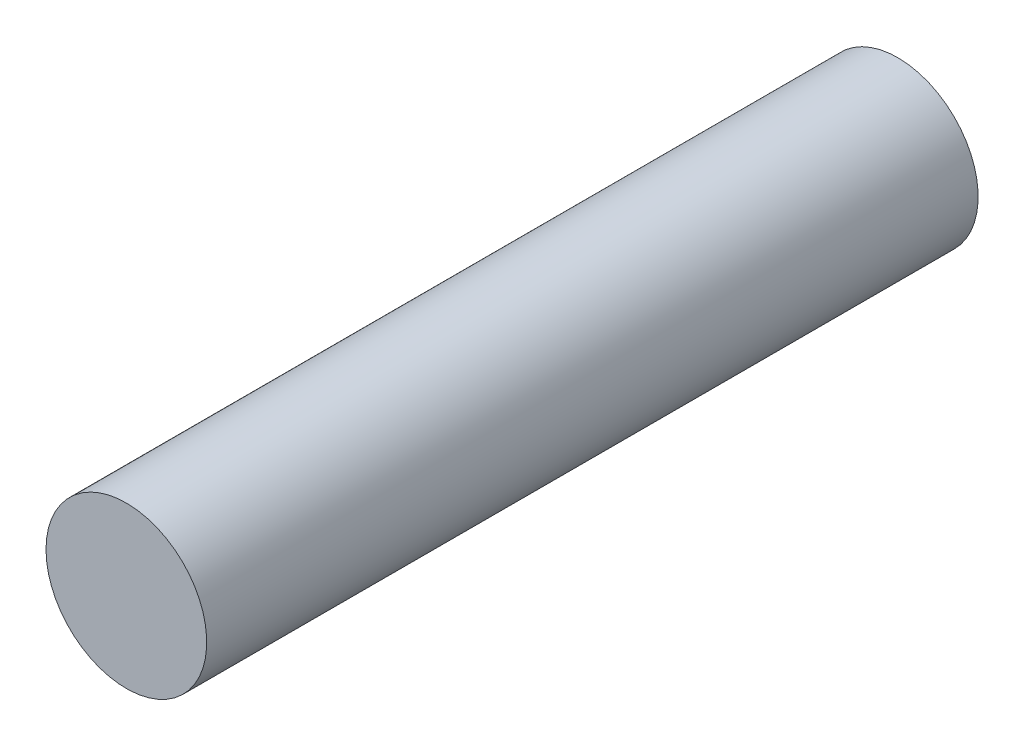
from build123d import *

# Parameters (mm, degrees)
BOSS_EXTRUDE1_DEPTH      = 76.2
BOSS_EXTRUDE1_DEPTH_BACK = 76.2
SKETCH3_R                = 15.875


with BuildPart() as part:
    # Sketch3 → Boss-Extrude1 (new, two sides: drawn at the far end of the back side and taken through both)
    with BuildSketch(Plane.XY.offset(-BOSS_EXTRUDE1_DEPTH_BACK)):
        with Locations(Location((0, 0, 0), (0, 0, 180))):
            Circle(SKETCH3_R)
    extrude(amount=BOSS_EXTRUDE1_DEPTH + BOSS_EXTRUDE1_DEPTH_BACK)


solid = part.part
